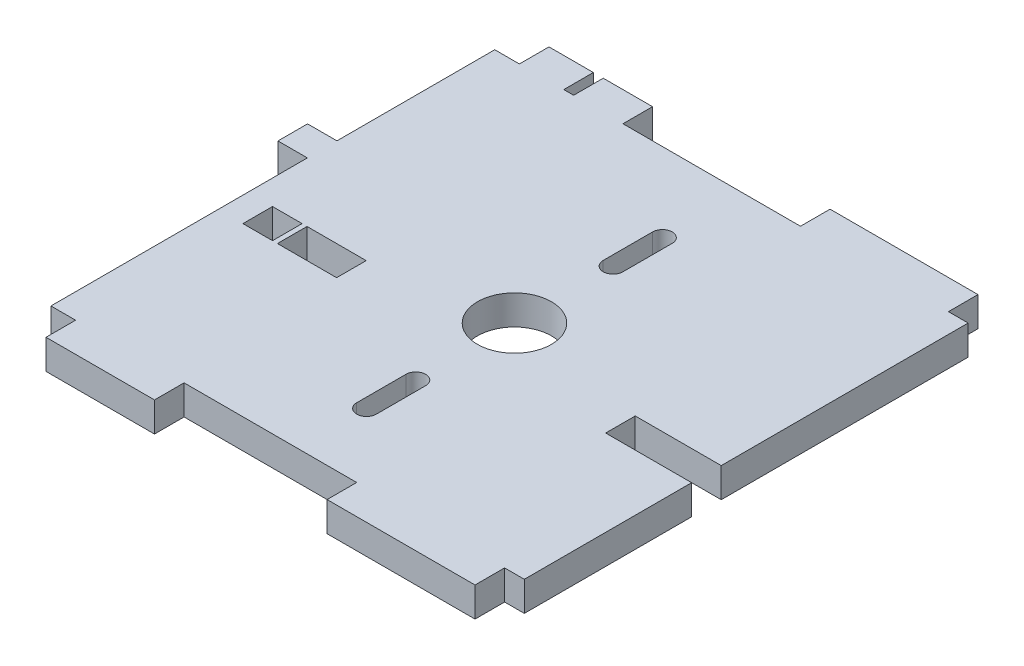
from build123d import *

# Parameters (mm, degrees)
CROQUIS1_R                 = 3.75
CROQUIS1_W                 = 6
CROQUIS1_H                 = 3.000001037
CROQUIS1_W_2               = 3
SALIENTE_EXTRUIR1_DEPTH    = 3
S_LIDO_MOVER_COPIAR1_ANGLE = 90


with BuildPart() as part:
    # Croquis1 → Saliente-Extruir1 (new body)
    with BuildSketch(Plane.XY):
        Polygon((41630.614837019, 58015.908765172), (41648.614837019, 58015.908765172), (41648.614837019, 58018.908765172), (41663.614837019, 58018.908765172), (41663.614837019, 58015.908765172), (41665.614813532, 58015.908765172), (41665.614813532, 57990.873439675), (41656.89673353, 57990.873439675), (41656.89673353, 57987.873438638), (41665.614813532, 57987.873438638), (41665.614813532, 57970.908765172), (41663.615195237, 57970.908765172), (41663.615195237, 57967.908765172), (41648.615195237, 57967.908765172), (41648.615195237, 57970.908765172), (41631.115195237, 57970.908765172), (41631.115195237, 57967.908765172), (41620.114837019, 57967.908765172), (41620.114837019, 57970.908765172), (41617.614837019, 57970.908765172), (41617.614837019, 57996.908765172), (41614.63346575, 57996.908765172), (41614.63346575, 57999.908765172), (41617.614837019, 57999.908765172), (41617.614837019, 58015.908765172), (41620.114837019, 58015.908765172), (41620.114837019, 58018.908765172), (41624.614837019, 58018.908765172), (41624.614837019, 58015.908765172), (41625.614837019, 58015.908765172), (41625.614837019, 58018.908765172), (41630.614837019, 58018.908765172), align=None)
        with Locations((41642.614837019, 57992.908765172)):
            Circle(CROQUIS1_R, mode=Mode.SUBTRACT)
        with BuildLine():
            Line((41643.614837019, 57982.908765172), (41643.614837019, 57977.908765172))
            ThreePointArc((41643.614837019, 57977.908765172), (41642.614837019, 57976.908765172), (41641.614837019, 57977.908765172))
            Line((41641.614837019, 57977.908765172), (41641.614837019, 57982.908765172))
            ThreePointArc((41641.614837019, 57982.908765172), (41642.614837019, 57983.908765172), (41643.614837019, 57982.908765172))
        make_face(mode=Mode.SUBTRACT)
        with BuildLine():
            Line((41643.614837019, 58007.908765172), (41643.614837019, 58002.908765172))
            ThreePointArc((41643.614837019, 58002.908765172), (41642.614837019, 58001.908765172), (41641.614837019, 58002.908765172))
            Line((41641.614837019, 58002.908765172), (41641.614837019, 58007.908765172))
            ThreePointArc((41641.614837019, 58007.908765172), (41642.614837019, 58008.908765172), (41643.614837019, 58007.908765172))
        make_face(mode=Mode.SUBTRACT)
        with Locations((41626.616584693, 57989.373439157)):
            Rectangle(CROQUIS1_W, CROQUIS1_H, mode=Mode.SUBTRACT)
        with Locations((41621.616584693, 57989.373439157)):
            Rectangle(CROQUIS1_W_2, CROQUIS1_H, mode=Mode.SUBTRACT)
    extrude(amount=SALIENTE_EXTRUIR1_DEPTH)


with BuildPart() as part_1:
    # Sólido-Mover/Copiar1: moved
    add(part.part.rotate(Axis((0, 57992.408765172, 1.5), (-1, 0, 0)), S_LIDO_MOVER_COPIAR1_ANGLE))


solid = part_1.part
